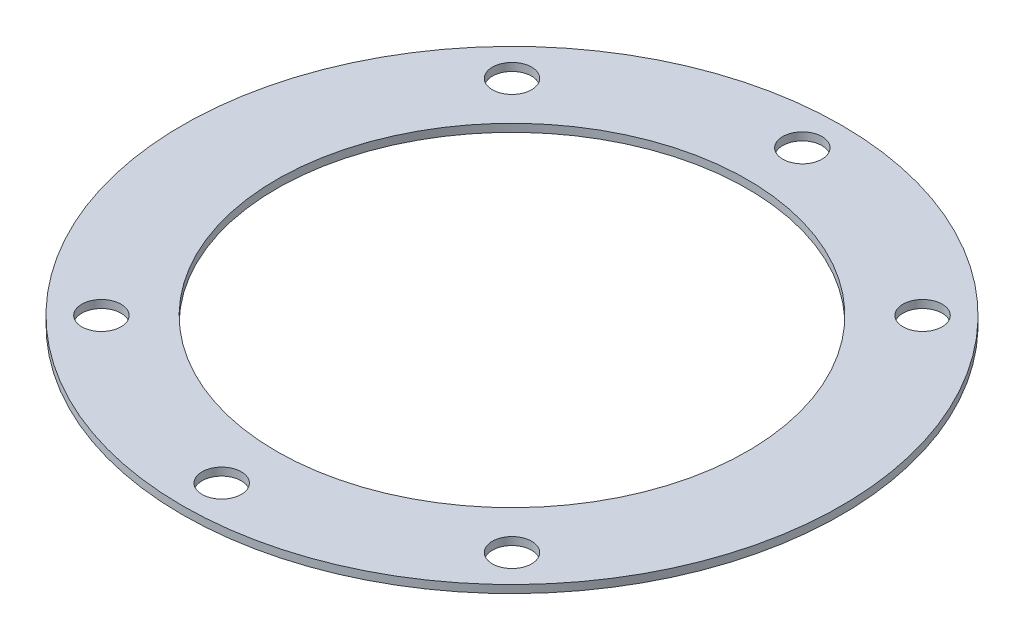
from build123d import *

# Parameters (mm, degrees)
ESQUISSE1_W                   = 12
ESQUISSE1_H                   = 1
DIAM_TRE_DU_PER_AGE_5_0_5_1_D = 5
DIAM_TRE_DU_PER_AGE_5_0_5_2_D = 5
R_P_TITION_CIRCULAIRE1_COUNT  = 4


with BuildPart() as part:
    # Esquisse1 → Révolution1 (revolve)
    with BuildSketch(Plane(origin=(0, 0, 0), x_dir=(0, 0, -1), z_dir=(1, 0, 0))):
        with Locations((-36, 0.5)):
            Rectangle(ESQUISSE1_W, ESQUISSE1_H)
    revolve(axis=Axis((0, 0, 0), (0, -1, 0)))

    # Diamètre du perçage Ø5.0 (5)1 (through all)
    with Locations(Plane(origin=(0, 1, 0), x_dir=(1, 0, 0), z_dir=(0, 1, 0))):
        with Locations((0, 37), (0, -37)):
            Hole(DIAM_TRE_DU_PER_AGE_5_0_5_1_D / 2)

    # Diamètre du perçage Ø5.0 (5)2 (through all)
    with Locations(Plane(origin=(0, 1, 0), x_dir=(1, 0, 0), z_dir=(0, 1, 0))):
        with Locations((-26.162950904, 26.162950904)):
            diam_tre_du_per_age_5_0_5_2 = Hole(DIAM_TRE_DU_PER_AGE_5_0_5_2_D / 2)

    # Répétition circulaire1: Diamètre du perçage Ø5.0 (5)2 ×4 about axis
    r_p_tition_circulaire1_axis = Axis((0, 0, 0), (0, 1, 0))
    for i in range(1, R_P_TITION_CIRCULAIRE1_COUNT):
        add(diam_tre_du_per_age_5_0_5_2.rotate(r_p_tition_circulaire1_axis, i * 360 / R_P_TITION_CIRCULAIRE1_COUNT), mode=Mode.SUBTRACT)


solid = part.part
